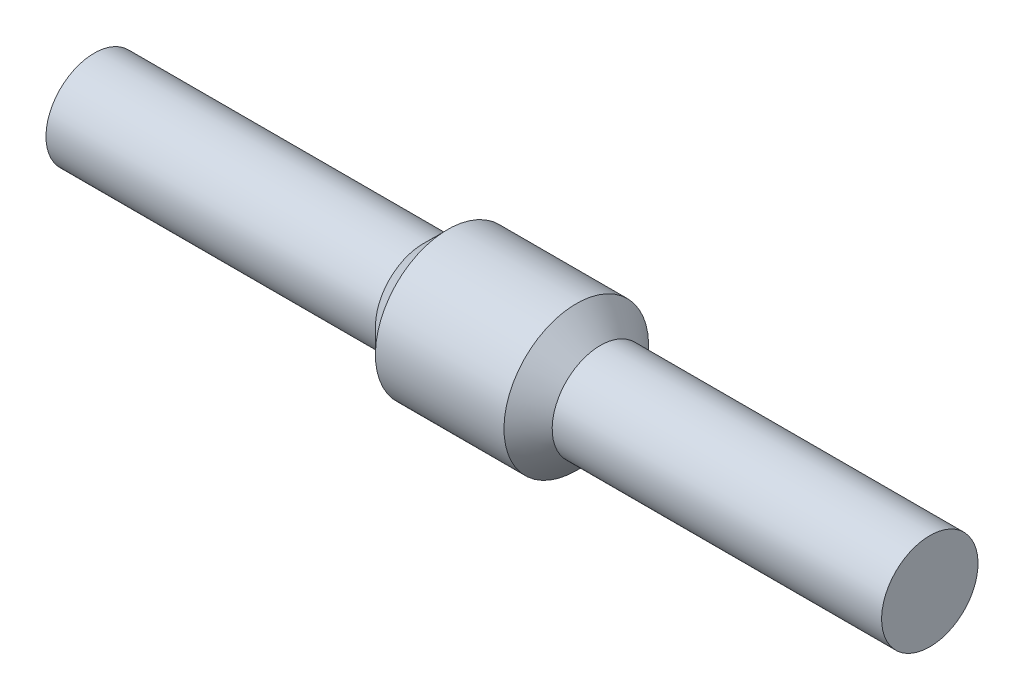
from build123d import *


with BuildPart() as part:
    # Sketch1 → Revolve1 (revolve)
    with BuildSketch(Plane.XY, mode=Mode.PRIVATE) as revolve1_sk:
        Polygon((-13, 0), (-13, 1.5), (-2.75, 1.5), (-2, 2.25), (2, 2.25), (2.75, 1.5), (13, 1.5), (13, 0), align=None)
    revolve(revolve1_sk.sketch.rotate(Axis((-13, 0, 0), (1, 0, 0)), 180), axis=Axis((-13, 0, 0), (1, 0, 0)))


solid = part.part
